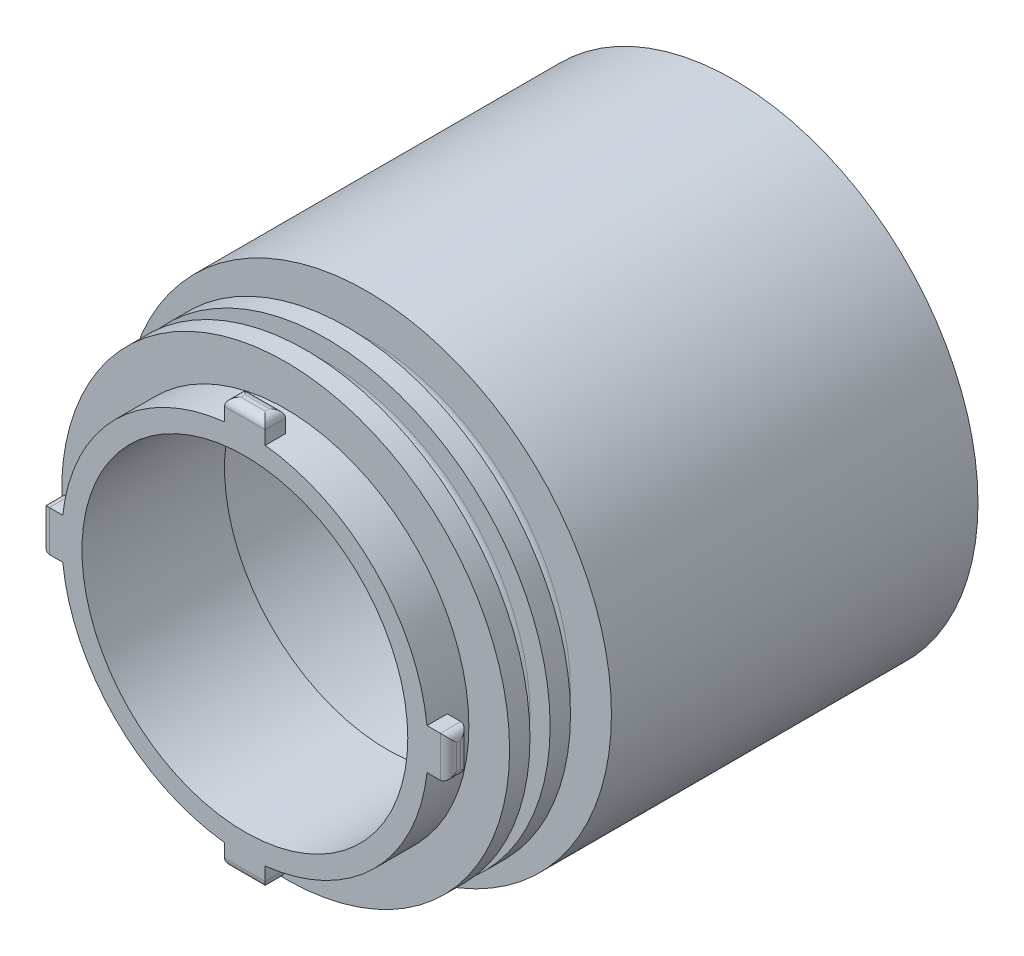
from build123d import *

# Parameters (mm, degrees)
BOSS_EXTRUDE1_DEPTH      = 63.5
BOSS_EXTRUDE1_DEPTH_BACK = 63.5
SKETCH3_W                = 12.7
SKETCH3_H                = 6.35
BOSS_EXTRUDE2_DEPTH      = 63.5
BOSS_EXTRUDE2_DEPTH_BACK = 63.5
SKETCH4_W                = 12.7
SKETCH4_H                = 6.35
CUT_EXTRUDE2_DEPTH       = 161.809264194
CUT_EXTRUDE2_DEPTH_BACK  = 161.809264194
SKETCH5_R                = 50.8
FILLET1_R                = 2.54


with BuildPart() as part:
    # Sketch2 → Revolve1 (revolve)
    with BuildSketch(Plane.YZ, mode=Mode.PRIVATE) as revolve1_sk:
        with BuildLine():
            Line((-76.2, -119.359706143), (-76.2, -5.059706143))
            Line((-76.2, -5.059706143), (-63.435713245, -5.059706143))
            ThreePointArc((-63.435713245, -5.059706143), (-60.260713245, -1.884706143), (-63.435713245, 1.290293857))
            Line((-63.435713245, 1.290293857), (-69.785713245, 1.290293857))
            Line((-69.785713245, 1.290293857), (-69.785713245, 7.640293857))
            Line((-69.785713245, 7.640293857), (-63.5, 7.640293857))
            ThreePointArc((-63.5, 7.640293857), (-60.325, 10.815293857), (-63.5, 13.990293857))
            Line((-63.5, 13.990293857), (-69.85, 13.990293857))
            Line((-69.85, 13.990293857), (-69.85, 20.340293857))
            Line((-69.85, 20.340293857), (-57.15, 20.340293857))
            Line((-57.15, 20.340293857), (-57.15, 33.040293857))
            Line((-57.15, 33.040293857), (-50.8, 33.040293857))
            Line((-50.8, 33.040293857), (-50.8, -11.409706143))
            Line((-50.8, -11.409706143), (-63.5, -11.409706143))
            Line((-63.5, -11.409706143), (-63.5, -81.259706143))
            Line((-63.5, -81.259706143), (-69.785713245, -81.259706143))
            Line((-69.785713245, -81.259706143), (-69.785713245, -119.359706143))
            Line((-69.785713245, -119.359706143), (-76.2, -119.359706143))
        make_face()
    revolve(revolve1_sk.sketch.rotate(Axis((0, 0, 44.403866564), (0, 0, -1)), 270), axis=Axis((0, 0, 44.403866564), (0, 0, -1)))

    # Sketch3 → Boss-Extrude1 (add, two sides: drawn at the far end of the back side and taken through both)
    with BuildSketch(Plane.YZ.offset(-BOSS_EXTRUDE1_DEPTH_BACK)):
        with Locations((0, 29.865293857)):
            Rectangle(SKETCH3_W, SKETCH3_H)
    extrude(amount=BOSS_EXTRUDE1_DEPTH + BOSS_EXTRUDE1_DEPTH_BACK)

    # Sketch4 → Boss-Extrude2 (add, two sides: drawn at the far end of the back side and taken through both)
    with BuildSketch(Plane(origin=(0, 0, 0), x_dir=(-1, 0, 0), z_dir=(0, 1, 0)).offset(-BOSS_EXTRUDE2_DEPTH_BACK)):
        with Locations((0, 29.865293857)):
            Rectangle(SKETCH4_W, SKETCH4_H)
    extrude(amount=BOSS_EXTRUDE2_DEPTH + BOSS_EXTRUDE2_DEPTH_BACK)

    # Sketch5 → Cut-Extrude2 (cut, two sides: drawn at the far end of the back side and taken through both)
    with BuildSketch(Plane(origin=(0, 0, 0), x_dir=(0, 1, 0), z_dir=(0, 0, 1)).offset(-CUT_EXTRUDE2_DEPTH_BACK)):
        with Locations(Location((0, 0, 0), (0, 0, 270))):
            Circle(SKETCH5_R)
    extrude(amount=CUT_EXTRUDE2_DEPTH + CUT_EXTRUDE2_DEPTH_BACK, mode=Mode.SUBTRACT)

    # Fillet1
    fillet1_edges = [part.edges().sort_by_distance(p)[0] for p in [
        (6.35, 63.5, 29.865293857),
        (0, 63.5, 26.690293857),
        (-6.35, 63.5, 29.865293857),
        (0, 63.5, 33.040293857),
        (-63.5, -6.35, 29.865293857),
        (-63.5, 0, 33.040293857),
        (-63.5, 6.35, 29.865293857),
        (-63.5, 0, 26.690293857),
        (63.5, -6.35, 29.865293857),
        (63.5, 0, 26.690293857),
        (63.5, 6.35, 29.865293857),
        (63.5, 0, 33.040293857),
        (6.35, -63.5, 29.865293857),
        (0, -63.5, 33.040293857),
        (-6.35, -63.5, 29.865293857),
        (0, -63.5, 26.690293857),
    ]]
    fillet(fillet1_edges, radius=FILLET1_R)


solid = part.part
